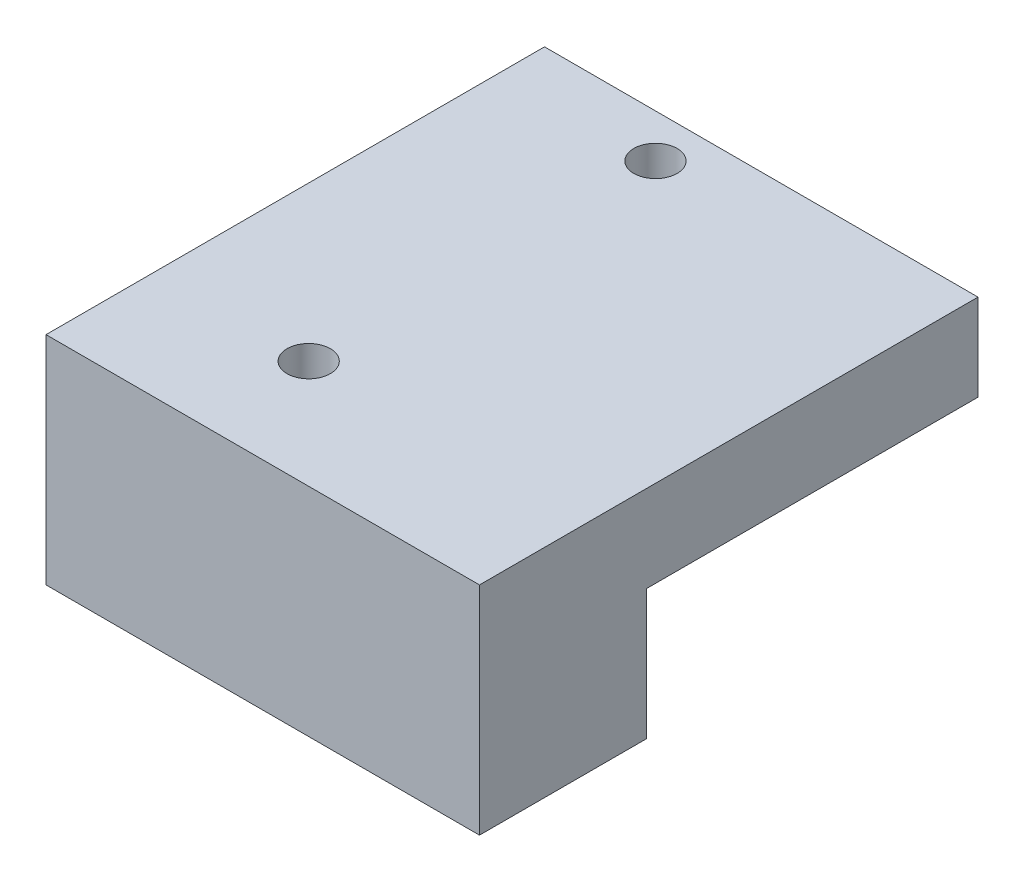
from build123d import *

# Parameters (mm, degrees)
SKETCH1_W           = 20
SKETCH1_H           = 23
BOSS_EXTRUDE1_DEPTH = 10
CUT_EXTRUDE13_DEPTH = 7
SKETCH16_R          = 4.55
CUT_EXTRUDE14_DEPTH = 7
SKETCH18_W          = 14.55
SKETCH18_H          = 7
CUT_EXTRUDE16_DEPTH = 1.5
SKETCH20_R          = 1
CUT_EXTRUDE18_DEPTH = 5
SKETCH21_W          = 15.3
SKETCH21_H          = 6
CUT_EXTRUDE19_DEPTH = 5


with BuildPart() as part:
    # Sketch1 → Boss-Extrude1 (new body)
    with BuildSketch(Plane(origin=(0, 0, 0), x_dir=(1, 0, 0), z_dir=(0, 1, 0))):
        Rectangle(SKETCH1_W, SKETCH1_H)
    extrude(amount=BOSS_EXTRUDE1_DEPTH)

    # Sketch15 → Cut-Extrude13 (cut)
    with BuildSketch(Plane.XZ):
        Polygon((0, -11.5), (-7, -11.5), (-7, 8.5), (7, 8.5), (7, -11.5), align=None)
    extrude(amount=-CUT_EXTRUDE13_DEPTH, mode=Mode.SUBTRACT)

    # Sketch16 → Cut-Extrude14 (cut)
    with BuildSketch(Plane.ZY.offset(10)):
        with Locations((-1.5, 0)):
            Circle(SKETCH16_R)
    extrude(amount=-CUT_EXTRUDE14_DEPTH, mode=Mode.SUBTRACT)

    # Sketch18 → Cut-Extrude16 (cut)
    with BuildSketch(Plane(origin=(-7, 0, 0), x_dir=(0, 0, -1), z_dir=(1, 0, 0))):
        with Locations((1.5, 3.5)):
            Rectangle(SKETCH18_W, SKETCH18_H)
    extrude(amount=-CUT_EXTRUDE16_DEPTH, mode=Mode.SUBTRACT)

    # Sketch20 → Cut-Extrude18 (cut)
    with BuildSketch(Plane(origin=(0, 10, 0), x_dir=(1, 0, 0), z_dir=(0, 1, 0))):
        with Locations(Location((-2.88, 9.5, 0), (0, 0, 270))):
            Circle(SKETCH20_R)
        with Locations(Location((-2.88, -6.5, 0), (0, 0, 270))):
            Circle(SKETCH20_R)
    extrude(amount=-CUT_EXTRUDE18_DEPTH, mode=Mode.SUBTRACT)

    # Sketch21 → Cut-Extrude19 (cut)
    with BuildSketch(Plane(origin=(10, 0, 0), x_dir=(0, 0, -1), z_dir=(1, 0, 0))):
        with Locations((3.85, 3)):
            Rectangle(SKETCH21_W, SKETCH21_H)
    extrude(amount=-CUT_EXTRUDE19_DEPTH, mode=Mode.SUBTRACT)


solid = part.part
